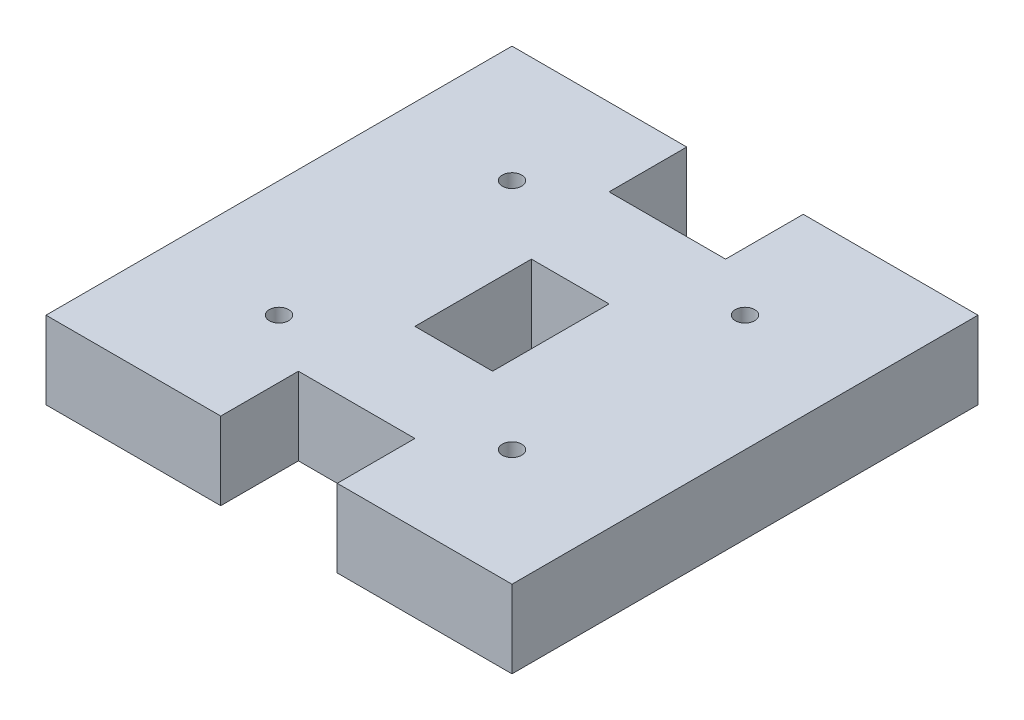
from build123d import *

# Parameters (mm, degrees)
ESBO_O1_W                = 60
ESBO_O1_H                = 60
RESSALTO_EXTRUS_O1_DEPTH = 10
ESBO_O2_W                = 15
ESBO_O2_H                = 10
CORTE_EXTRUS_O1_DEPTH    = 10
ESBO_O3_W                = 15
ESBO_O3_H                = 10
CORTE_EXTRUS_O2_DEPTH    = 10
ESBO_O4_W                = 10
ESBO_O4_H                = 15
CORTE_EXTRUS_O3_DEPTH    = 86.440037453
ESBO_O5_R                = 1.25
CORTE_EXTRUS_O4_DEPTH    = 86.440037453


with BuildPart() as part:
    # Esboço1 → Ressalto-extrusão1 (new body)
    with BuildSketch(Plane(origin=(0, 0, 0), x_dir=(1, 0, 0), z_dir=(0, 1, 0))):
        with Locations((30, 30)):
            Rectangle(ESBO_O1_W, ESBO_O1_H)
    extrude(amount=RESSALTO_EXTRUS_O1_DEPTH)

    # Esboço2 → Corte-extrusão1 (cut)
    with BuildSketch(Plane.XY):
        with Locations((30, 5)):
            Rectangle(ESBO_O2_W, ESBO_O2_H)
    extrude(amount=-CORTE_EXTRUS_O1_DEPTH, mode=Mode.SUBTRACT)

    # Esboço3 → Corte-extrusão2 (cut)
    with BuildSketch(Plane(origin=(0, 0, -60), x_dir=(-1, 0, 0), z_dir=(0, 0, -1))):
        with Locations((-30, 5)):
            Rectangle(ESBO_O3_W, ESBO_O3_H)
    extrude(amount=-CORTE_EXTRUS_O2_DEPTH, mode=Mode.SUBTRACT)

    # Esboço4 → Corte-extrusão3 (cut, through all)
    with BuildSketch(Plane(origin=(0, 10, 0), x_dir=(1, 0, 0), z_dir=(0, 1, 0))):
        with Locations((30, 30)):
            Rectangle(ESBO_O4_W, ESBO_O4_H)
    extrude(amount=-CORTE_EXTRUS_O3_DEPTH, mode=Mode.SUBTRACT)

    # Esboço5 → Corte-extrusão4 (cut, through all)
    with BuildSketch(Plane(origin=(0, 10, 0), x_dir=(1, 0, 0), z_dir=(0, 1, 0))):
        with Locations(Location((45, 45, 0), (0, 0, 270))):
            Circle(ESBO_O5_R)
        with Locations(Location((15, 45, 0), (0, 0, 270))):
            Circle(ESBO_O5_R)
        with Locations(Location((45, 15, 0), (0, 0, 270))):
            Circle(ESBO_O5_R)
        with Locations(Location((15, 15, 0), (0, 0, 270))):
            Circle(ESBO_O5_R)
    extrude(amount=-CORTE_EXTRUS_O4_DEPTH, mode=Mode.SUBTRACT)


solid = part.part
